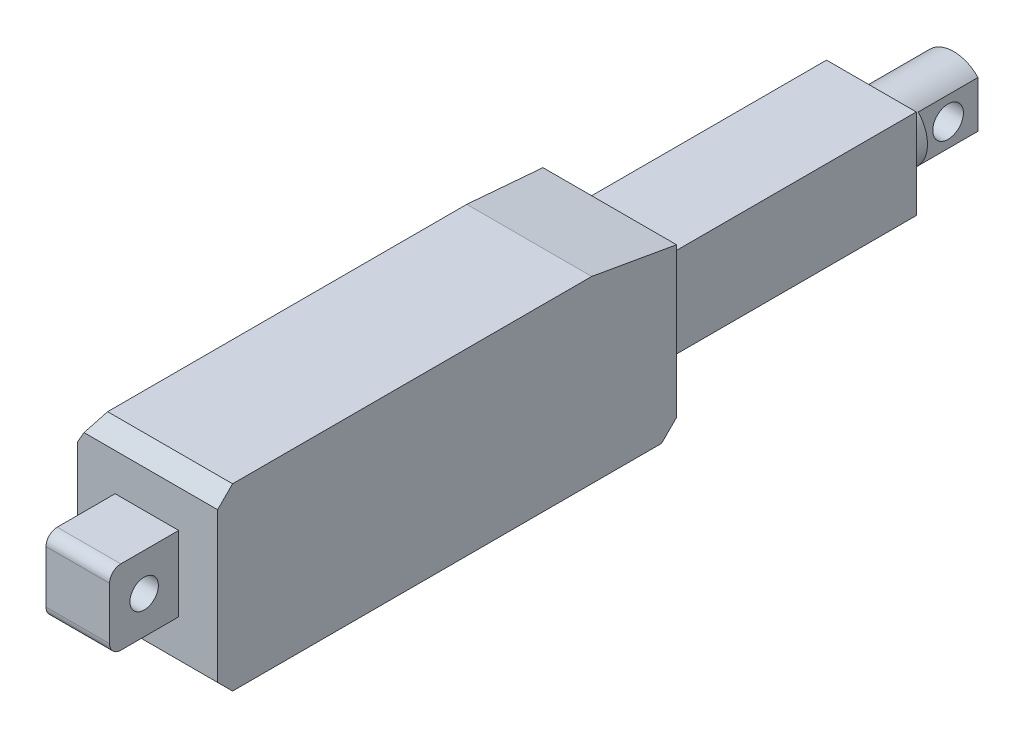
from build123d import *
from OCP.BRepFilletAPI import BRepFilletAPI_MakeChamfer

# Parameters (mm, degrees)
SKETCH1_W           = 18.7
SKETCH1_H           = 24
BOSS_EXTRUDE1_DEPTH = 61.35
CHAMFER1_SIZE       = 2
CHAMFER1_SIZE2      = 3.464101615
CHAMFER2_SIZE       = 2
CHAMFER3_SIZE       = 2
CHAMFER3_SIZE2      = 11.342563639
SKETCH2_W           = 12
SKETCH2_H           = 12
BOSS_EXTRUDE2_DEPTH = 35.4
SKETCH3_R           = 4.5
BOSS_EXTRUDE3_DEPTH = 11
CUT_EXTRUDE1_START  = -8
CUT_EXTRUDE1_DEPTH  = 8
SKETCH5_W           = 8.5
SKETCH5_H           = 10
BOSS_EXTRUDE4_DEPTH = 9.24
SKETCH7_R           = 1.9
CUT_EXTRUDE2_DEPTH  = 10
FILLET1_R           = 1.5
SKETCH8_R           = 2.05
CUT_EXTRUDE3_DEPTH  = 73.702875459


with BuildPart() as part:
    # Sketch1 → Boss-Extrude1 (new body)
    with BuildSketch(Plane.XY):
        Rectangle(SKETCH1_W, SKETCH1_H)
    extrude(amount=BOSS_EXTRUDE1_DEPTH)

    # Chamfer1: one chamfer whose edges measure the first distance from different faces: ONE call of the kernel's chamfer builder (chamfer() names one face for all edges)
    chamfer1_edges_1 = [part.edges().sort_by_distance(p)[0] for p in [
        (-9.35, 12, 30.675),
    ]]
    chamfer1_side_1 = [part.faces().sort_by_distance(p)[0] for p in [
        (0, 12, 30.675),
    ]]
    chamfer1_edges_2 = [part.edges().sort_by_distance(p)[0] for p in [
        (-9.35, -12, 30.675),
    ]]
    chamfer1_side_2 = [part.faces().sort_by_distance(p)[0] for p in [
        (0, -12, 30.675),
    ]]
    chamfer1 = BRepFilletAPI_MakeChamfer(part.part.solid().wrapped)
    for e in chamfer1_edges_1:
        chamfer1.Add(CHAMFER1_SIZE, CHAMFER1_SIZE2, e.wrapped, chamfer1_side_1[0].wrapped)  # the first distance lies on this face
    for e in chamfer1_edges_2:
        chamfer1.Add(CHAMFER1_SIZE, CHAMFER1_SIZE2, e.wrapped, chamfer1_side_2[0].wrapped)  # the first distance lies on this face
    add(Compound.cast(chamfer1.Shape()), mode=Mode.REPLACE)

    # Chamfer2
    chamfer2_edges = [part.edges().sort_by_distance(p)[0] for p in [
        (1, -12, 0),
        (1, 12, 61.35),
        (1, -12, 61.35),
    ]]
    chamfer(chamfer2_edges, length=CHAMFER2_SIZE)

    # Chamfer3
    chamfer3_edges = [part.edges().sort_by_distance(p)[0] for p in [
        (1, 12, 0),
    ]]
    chamfer3_side = [part.faces().sort_by_distance(p)[0] for p in [
        (0.087625567, 0.932238812, 0),
    ]]
    chamfer(chamfer3_edges, length=CHAMFER3_SIZE, length2=CHAMFER3_SIZE2, reference=chamfer3_side[0])

    # Sketch2 → Boss-Extrude2 (add)
    with BuildSketch(Plane(origin=(0, 0, 0), x_dir=(-1, 0, 0), z_dir=(0, 0, -1))):
        Rectangle(SKETCH2_W, SKETCH2_H)
    extrude(amount=BOSS_EXTRUDE2_DEPTH)

    # Sketch3 → Boss-Extrude3 (add)
    with BuildSketch(Plane(origin=(0, 0, -35.4), x_dir=(-1, 0, 0), z_dir=(0, 0, -1))):
        Circle(SKETCH3_R)
    extrude(amount=BOSS_EXTRUDE3_DEPTH)

    # Sketch4 → Cut-Extrude1 (cut)
    with BuildSketch(Plane(origin=(0, 0, -46.4), x_dir=(-1, 0, 0), z_dir=(0, 0, -1)).offset(CUT_EXTRUDE1_START)):
        with BuildLine():
            ThreePointArc((-3.25, 3.112474899), (-4.5, 0), (-3.25, -3.112474899))
            Line((-3.25, -3.112474899), (-3.25, 3.112474899))
        make_face()
        with BuildLine():
            Line((3.25, 3.112474899), (3.25, -3.112474899))
            ThreePointArc((3.25, -3.112474899), (4.175823272, -1.677050983), (4.5, 0))
            ThreePointArc((4.5, 0), (4.175823272, 1.677050983), (3.25, 3.112474899))
        make_face()
    extrude(amount=CUT_EXTRUDE1_DEPTH, mode=Mode.SUBTRACT)

    # Sketch5 → Boss-Extrude4 (add)
    with BuildSketch(Plane.XY.offset(61.35)):
        with Locations((-0.1, 0)):
            Rectangle(SKETCH5_W, SKETCH5_H)
    extrude(amount=BOSS_EXTRUDE4_DEPTH)

    # Sketch7 → Cut-Extrude2 (cut)
    with BuildSketch(Plane(origin=(4.15, 0, 0), x_dir=(0, 0, -1), z_dir=(1, 0, 0))):
        with Locations((-65.97, 0)):
            Circle(SKETCH7_R)
    extrude(amount=-CUT_EXTRUDE2_DEPTH, mode=Mode.SUBTRACT)

    # Fillet1
    fillet1_edges = [part.edges().sort_by_distance(p)[0] for p in [
        (-0.1, 5, 70.59),
        (-0.1, -5, 70.59),
    ]]
    fillet(fillet1_edges, radius=FILLET1_R)

    # Sketch8 → Cut-Extrude3 (cut, through all)
    with BuildSketch(Plane(origin=(3.25, 0, 0), x_dir=(0, 0, -1), z_dir=(1, 0, 0))):
        with Locations((42.4, 0)):
            Circle(SKETCH8_R)
    extrude(amount=-CUT_EXTRUDE3_DEPTH, mode=Mode.SUBTRACT)


solid = part.part
